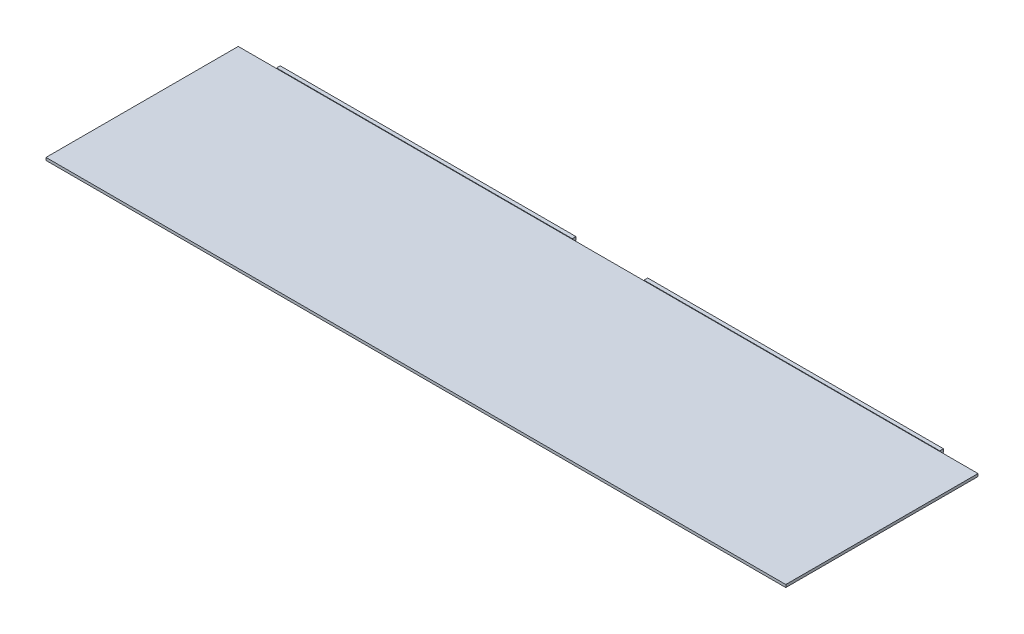
from build123d import *

# Parameters (mm, degrees)
SKETCH1_W           = 635.3556
SKETCH1_H           = 165.1
BOSS_EXTRUDE1_DEPTH = 1.143
SKETCH2_W           = 254
SKETCH2_H           = 2.7305
BOSS_EXTRUDE2_DEPTH = 3.175


with BuildPart() as part:
    # Sketch1 → Boss-Extrude1 (new, symmetric)
    with BuildSketch(Plane(origin=(0, 0, 0), x_dir=(1, 0, 0), z_dir=(0, 1, 0))):
        Rectangle(SKETCH1_W, SKETCH1_H)
    extrude(amount=BOSS_EXTRUDE1_DEPTH, both=True)

    # Sketch2 → Boss-Extrude2 (add)
    with BuildSketch(Plane(origin=(0, 0, -82.55), x_dir=(-1, 0, 0), z_dir=(0, 0, -1))):
        with Locations((-157.8229, 0.22225)):
            Rectangle(SKETCH2_W, SKETCH2_H)
        with Locations((157.8229, 0.22225)):
            Rectangle(SKETCH2_W, SKETCH2_H)
    extrude(amount=BOSS_EXTRUDE2_DEPTH)


solid = part.part
